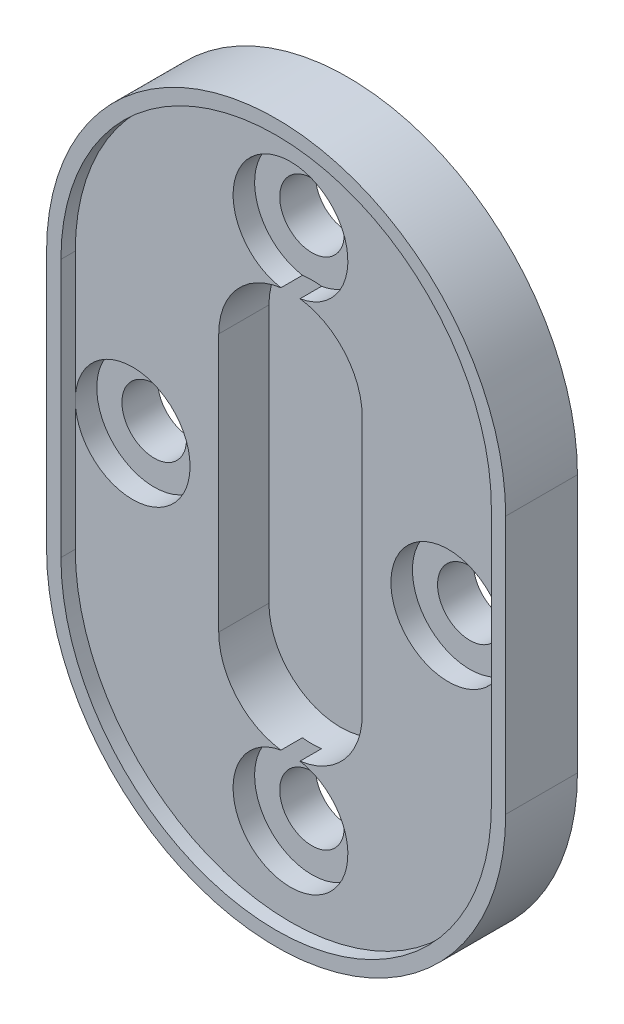
from build123d import *

# Parameters (mm, degrees)
BOSS_EXTRUDE1_DEPTH                     = 4
CUT_EXTRUDE1_DEPTH                      = 3.5
BOSS_EXTRUDE2_DEPTH                     = 1
CBORE_FOR_M5_HEX_HEAD_BOLT1_D           = 4.5
CBORE_FOR_M5_HEX_HEAD_BOLT1_CBORE_D     = 8
CBORE_FOR_M5_HEX_HEAD_BOLT1_CBORE_DEPTH = 1.5


with BuildPart() as part:
    # Sketch1 → Boss-Extrude1 (new body)
    with BuildSketch(Plane.XY):
        with BuildLine():
            Line((-16, -9), (-16, 9))
            ThreePointArc((-16, 9), (0, 25), (16, 9))
            Line((16, 9), (16, -9))
            ThreePointArc((16, -9), (0, -25), (-16, -9))
        make_face()
    extrude(amount=BOSS_EXTRUDE1_DEPTH)

    # Sketch2 → Cut-Extrude1 (cut)
    with BuildSketch(Plane.XY.offset(4)):
        with BuildLine():
            Line((-5, -9), (-5, 9))
            ThreePointArc((-5, 9), (0, 14), (5, 9))
            Line((5, 9), (5, -9))
            ThreePointArc((5, -9), (0, -14), (-5, -9))
        make_face()
    extrude(amount=-CUT_EXTRUDE1_DEPTH, mode=Mode.SUBTRACT)

    # Sketch3 → Boss-Extrude2 (add)
    with BuildSketch(Plane.XY.offset(4)):
        with BuildLine():
            Line((16, -9), (16, 9))
            ThreePointArc((16, 9), (0, 25), (-16, 9))
            Line((-16, 9), (-16, -9))
            ThreePointArc((-16, -9), (0, -25), (16, -9))
        make_face()
        with BuildLine():
            Line((-15, 9), (-15, -9))
            ThreePointArc((-15, -9), (0, -24), (15, -9))
            Line((15, -9), (15, 9))
            ThreePointArc((15, 9), (0, 24), (-15, 9))
        make_face(mode=Mode.SUBTRACT)
    extrude(amount=BOSS_EXTRUDE2_DEPTH)

    # CBORE for M5 Hex Head Bolt1 (through all)
    with Locations(Plane.XY.offset(4)):
        with Locations((0, 17.9), (11, 0), (-11, 0), (0, -17.9)):
            CounterBoreHole(CBORE_FOR_M5_HEX_HEAD_BOLT1_D / 2, CBORE_FOR_M5_HEX_HEAD_BOLT1_CBORE_D / 2, CBORE_FOR_M5_HEX_HEAD_BOLT1_CBORE_DEPTH)


solid = part.part
